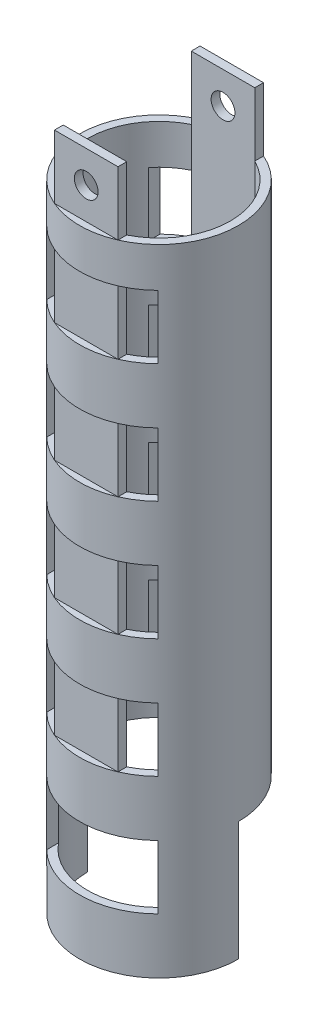
from build123d import *

# Parameters (mm, degrees)
SKETCH1_R           = 50
BOSS_EXTRUDE1_DEPTH = 400
SHELL1_T            = -10
SKETCH2_R           = 40
CUT_EXTRUDE1_DEPTH  = 400
SKETCH3_W           = 70
SKETCH3_H           = 40
CUT_EXTRUDE2_DEPTH  = 200
SKETCH4_R           = 45
CUT_EXTRUDE3_DEPTH  = 400
CUT_EXTRUDE7_DEPTH  = 75
BOSS_EXTRUDE3_START = -325
SKETCH9_W           = 40
SKETCH9_H           = 5.514468209
BOSS_EXTRUDE3_DEPTH = 365
SKETCH10_R          = 7.5
CUT_EXTRUDE8_DEPTH  = 454.081202098


with BuildPart() as part:
    # Sketch1 → Boss-Extrude1 (new body)
    with BuildSketch(Plane(origin=(0, 0, 0), x_dir=(1, 0, 0), z_dir=(0, 1, 0))):
        with Locations(Location((0, 0, 0), (0, 0, 90))):
            Circle(SKETCH1_R)
    extrude(amount=BOSS_EXTRUDE1_DEPTH)

    # Shell1
    shell1_openings = [part.faces().sort_by_distance(p)[0] for p in [
        (0, 0, 0),
    ]]
    offset(amount=SHELL1_T, openings=shell1_openings, kind=Kind.INTERSECTION)

    # Sketch2 → Cut-Extrude1 (cut)
    with BuildSketch(Plane.XZ.offset(-390)):
        with Locations(Location((0, 0, 0), (0, 0, 270))):
            Circle(SKETCH2_R)
    extrude(amount=-CUT_EXTRUDE1_DEPTH, mode=Mode.SUBTRACT)

    # Sketch3 → Cut-Extrude2 (cut, symmetric)
    with BuildSketch(Plane.XY):
        with Locations((0, 355)):
            Rectangle(SKETCH3_W, SKETCH3_H)
        with Locations((0, 280)):
            Rectangle(SKETCH3_W, SKETCH3_H)
        with Locations((0, 205)):
            Rectangle(SKETCH3_W, SKETCH3_H)
        with Locations((0, 130)):
            Rectangle(SKETCH3_W, SKETCH3_H)
        with Locations((0, 55)):
            Rectangle(SKETCH3_W, SKETCH3_H)
    extrude(amount=CUT_EXTRUDE2_DEPTH, both=True, mode=Mode.SUBTRACT)

    # Sketch4 → Cut-Extrude3 (cut)
    with BuildSketch(Plane(origin=(0, 400, 0), x_dir=(1, 0, 0), z_dir=(0, 1, 0))):
        with Locations(Location((0, 0, 0), (0, 0, 270))):
            Circle(SKETCH4_R)
    extrude(amount=-CUT_EXTRUDE3_DEPTH, mode=Mode.SUBTRACT)

    # Sketch8 → Cut-Extrude7 (cut)
    with BuildSketch(Plane(origin=(0, 0, 0), x_dir=(1, 0, 0), z_dir=(0, 1, 0))):
        Polygon((-283.60679775, 0), (-50, 0), (50, 0), (283.60679775, 0), (283.60679775, 467.2135955), (-283.60679775, 467.2135955), align=None)
    extrude(amount=CUT_EXTRUDE7_DEPTH, mode=Mode.SUBTRACT)

    # Sketch9 → Boss-Extrude3 (add)
    with BuildSketch(Plane(origin=(0, 400, 0), x_dir=(1, 0, 0), z_dir=(0, 1, 0)).offset(BOSS_EXTRUDE3_START)):
        with Locations((0, 43.068522846)):
            Rectangle(SKETCH9_W, SKETCH9_H)
        with Locations((0, -43.068522846)):
            Rectangle(SKETCH9_W, SKETCH9_H)
    extrude(amount=BOSS_EXTRUDE3_DEPTH)

    # Sketch10 → Cut-Extrude8 (cut, through all)
    with BuildSketch(Plane(origin=(0, 0, -45.82575695), x_dir=(-1, 0, 0), z_dir=(0, 0, -1))):
        with Locations((0, 420)):
            Circle(SKETCH10_R)
    extrude(amount=-CUT_EXTRUDE8_DEPTH, mode=Mode.SUBTRACT)


solid = part.part
